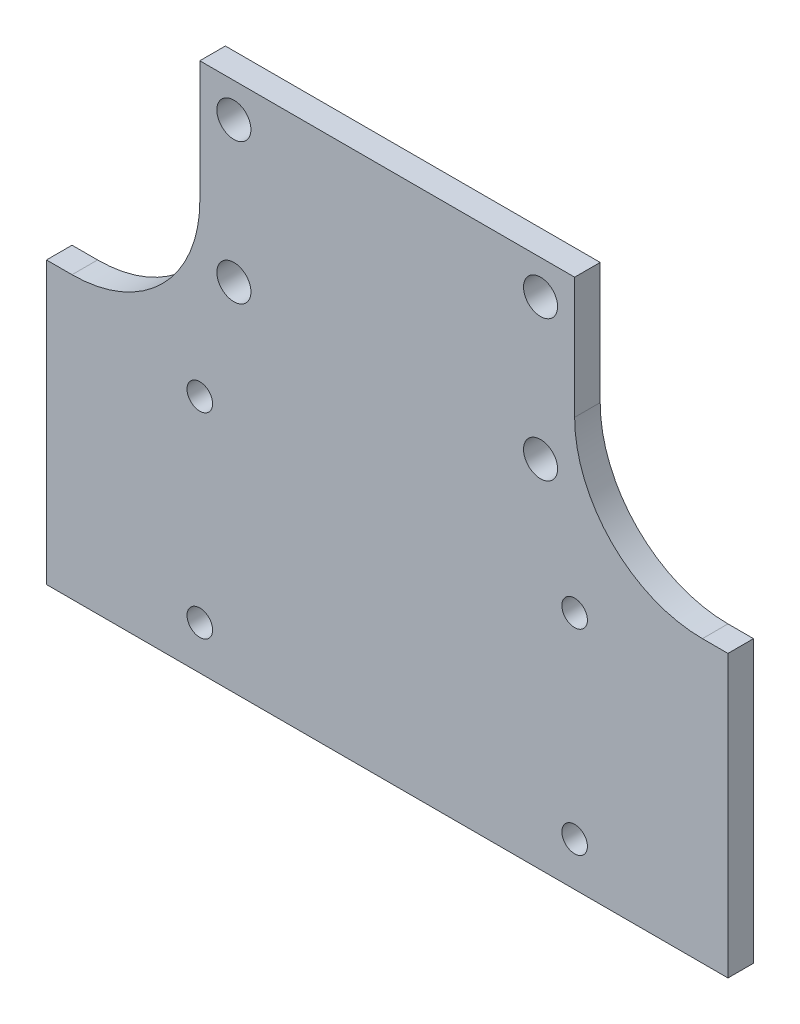
from build123d import *

# Parameters (mm, degrees)
EXTRUDE_1_DEPTH     = 3
SKETCH_2_R          = 2
CUT_EXTRUDE_1_DEPTH = 75.054456314
SKETCH_3_R          = 1.5
CUT_EXTRUDE_2_DEPTH = 75.054456314
FILLET_1_R          = 15


with BuildPart() as part:
    # 草图1 → 凸台-拉伸1 (new body)
    with BuildSketch(Plane.XY):
        Polygon((40, 0), (-40, 0), (-40, 33), (-22, 33), (-22, 62.25), (22, 62.25), (22, 33), (40, 33), align=None)
    extrude(amount=EXTRUDE_1_DEPTH)

    # 草图2 → 切除-拉伸1 (cut, through all)
    with BuildSketch(Plane.XY.offset(3)):
        with Locations((-18, 58.25)):
            Circle(SKETCH_2_R)
        with Locations((-18, 41.75)):
            Circle(SKETCH_2_R)
        with Locations((18, 41.75)):
            Circle(SKETCH_2_R)
        with Locations((18, 58.25)):
            Circle(SKETCH_2_R)
    extrude(amount=-CUT_EXTRUDE_1_DEPTH, mode=Mode.SUBTRACT)

    # 草图3 → 切除-拉伸2 (cut, through all)
    with BuildSketch(Plane.XY.offset(3)):
        with Locations((-22, 28.125)):
            Circle(SKETCH_3_R)
        with Locations((22, 28.125)):
            Circle(SKETCH_3_R)
        with Locations((22, 5.125)):
            Circle(SKETCH_3_R)
        with Locations((-22, 5.125)):
            Circle(SKETCH_3_R)
    extrude(amount=-CUT_EXTRUDE_2_DEPTH, mode=Mode.SUBTRACT)

    # 圆角1
    fillet_1_edges = [part.edges().sort_by_distance(p)[0] for p in [
        (-22, 33, 1.5),
        (22, 33, 1.5),
    ]]
    fillet(fillet_1_edges, radius=FILLET_1_R)


solid = part.part
